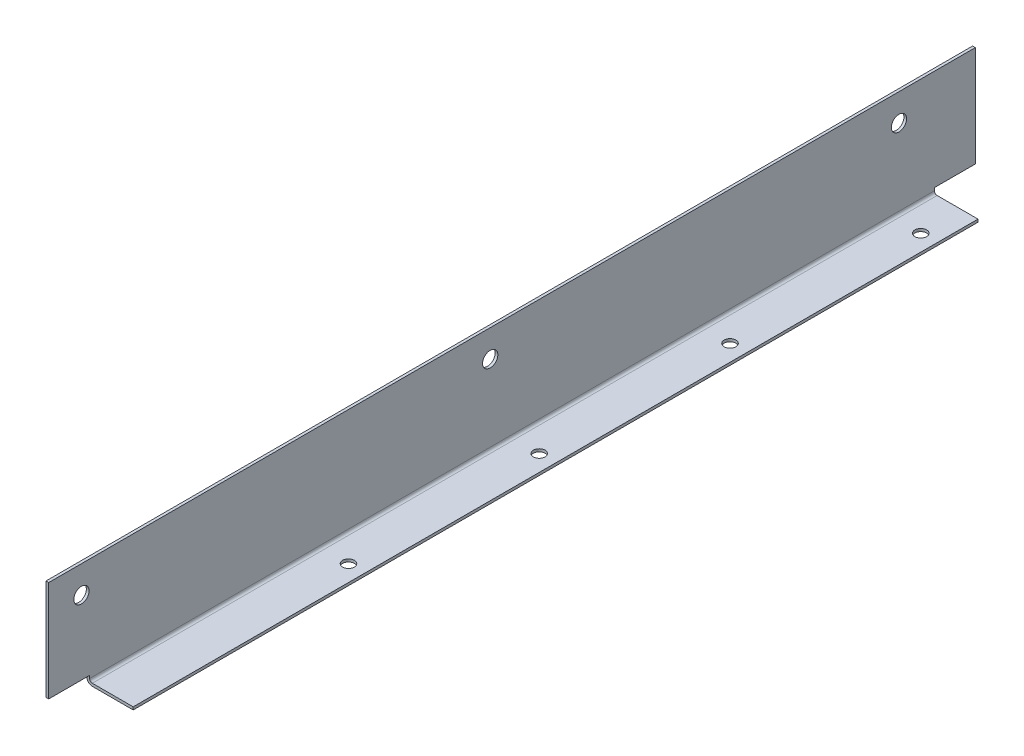
from build123d import *

# Parameters (mm, degrees)
EXTRUDE_1_DEPTH     = 340
SKETCH_2_R          = 2.8
CUT_EXTRUDE_1_DEPTH = 340
SKETCH_3_R          = 2.15
CUT_EXTRUDE_2_DEPTH = 340
SKETCH_4_W          = 37.623292197
SKETCH_4_H          = 20.655925128
SKETCH_4_W_2        = 42.547460075
SKETCH_4_H_2        = 15
CUT_EXTRUDE_3_DEPTH = 3


with BuildPart() as part:
    # Эскиз1 → Вытянуть1 (new body)
    with BuildSketch(Plane.XY):
        with BuildLine():
            Line((17, 0), (2, 0))
            ThreePointArc((2, 0), (0.585786438, 0.585786438), (0, 2))
            Line((0, 2), (0, 40))
            Line((0, 40), (1, 40))
            Line((1, 40), (1, 2))
            ThreePointArc((1, 2), (1.292893219, 1.292893219), (2, 1))
            Line((2, 1), (17, 1))
            Line((17, 1), (17, 0))
        make_face()
    extrude(amount=EXTRUDE_1_DEPTH)

    # Эскиз2 → Вырез-Вытянуть1 (cut)
    with BuildSketch(Plane.ZY):
        with Locations((28, 30)):
            Circle(SKETCH_2_R)
        with Locations((178, 30)):
            Circle(SKETCH_2_R)
        with Locations((328, 30)):
            Circle(SKETCH_2_R)
    extrude(amount=-CUT_EXTRUDE_1_DEPTH, mode=Mode.SUBTRACT)

    # Эскиз3 → Вырез-Вытянуть2 (cut)
    with BuildSketch(Plane.XZ):
        with Locations((11, 30)):
            Circle(SKETCH_3_R)
        with Locations((11, 100)):
            Circle(SKETCH_3_R)
        with Locations((11, 170)):
            Circle(SKETCH_3_R)
        with Locations((11, 240)):
            Circle(SKETCH_3_R)
    extrude(amount=-CUT_EXTRUDE_2_DEPTH, mode=Mode.SUBTRACT)

    # Эскиз4 → Вырез-Вытянуть3 (cut)
    with BuildSketch(Plane.XZ):
        with Locations((6.462024168, 335.327962564)):
            Rectangle(SKETCH_4_W, SKETCH_4_H)
        with Locations((3.999940229, 7.5)):
            Rectangle(SKETCH_4_W_2, SKETCH_4_H_2)
    extrude(amount=-CUT_EXTRUDE_3_DEPTH, mode=Mode.SUBTRACT)


solid = part.part
